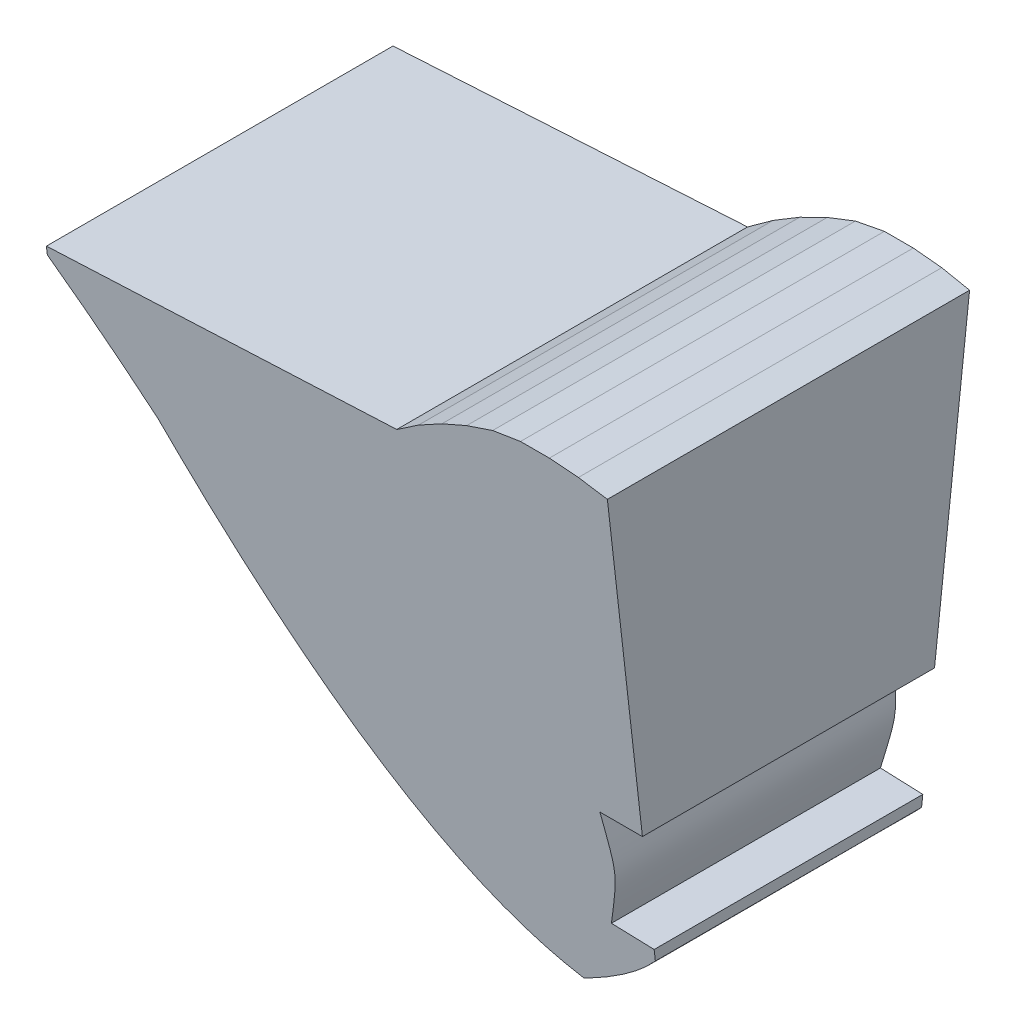
from build123d import *

# Parameters (mm, degrees)
SALIENTE_EXTRUIR1_DEPTH             = 7.21
SALIENTE_EXTRUIR2_DEPTH             = 7.21
SALIENTE_EXTRUIR2_DEPTH_BACK        = 7.21
CORTAR_EXTRUIR2_DEPTH               = 28.232395202
CORTAR_EXTRUIR2_DEPTH_BACK          = 28.232395202
SALIENTE_EXTRUIR3_REACH             = 29.232
SALIENTE_EXTRUIR3_DIRECTION_2_REACH = 29.232


with BuildPart() as part:
    # Croquis1 → Saliente-Extruir1 (new, symmetric)
    with BuildSketch(Plane.XY):
        with BuildLine():
            add(Edge.make_bspline(
                [(-18.945192114, 7.540918896), (-10.215008384, -3.697644103), (-2.846604825, -5.059081104)],
                knots=[0.497667241, 0.497667241, 0.497667241, 0.49955428, 0.49955428, 0.49955428], degree=2, weights=[1, 1, 1]))
            add(Edge.make_bspline(
                [(-2.846604825, -5.059081104), (-0.742366882, -3.9352066), (0.355125, -2.723253227)],
                knots=[0.498812075, 0.498812075, 0.498812075, 0.499412845, 0.499412845, 0.499412845], degree=2, weights=[1, 1, 1]))
            Line((0.355125, -2.723253227), (0.355125, -2.284841781))
            Line((0.355125, -2.284841781), (-1.394875, -2.223730435))
            add(Edge.make_bspline(
                [(-1.394875, -2.223730435), (-0.90753067, -0.123730435), (-1.394875, 1.976269565)],
                knots=[0, 0, 0, 1, 1, 1], degree=2, weights=[1, 3.231801219, 1]))
            Line((-1.394875, 1.976269565), (0.355125, 2.284841781))
            Line((0.355125, 2.284841781), (0.355125, 3.001549529))
            add(Edge.make_bspline(
                [(0.355125, 3.001549529), (-1.44872627, 6.058427314), (-6.994875026, 10.477389992)],
                knots=[0.500820705, 0.500820705, 0.500820705, 0.502013312, 0.502013312, 0.502013312], degree=2, weights=[1, 1, 1]))
            Line((-6.994875026, 10.477389992), (-8.981845695, 12.608155172))
            Line((-8.981845695, 12.608155172), (-23.035921146, 11.871612288))
            Line((-23.035921146, 11.871612288), (-23.035921146, 11.54013782))
            ThreePointArc((-23.035921146, 11.54013782), (-20.949684518, 9.582335705), (-18.945192114, 7.540918896))
        make_face()
    extrude(amount=SALIENTE_EXTRUIR1_DEPTH, both=True)

    # Croquis4 → Saliente-Extruir2 (add, two sides: drawn at the far end of the back side and taken through both)
    with BuildSketch(Plane.XY.offset(-SALIENTE_EXTRUIR2_DEPTH_BACK)):
        Polygon((-1.394875, 1.976269565), (0.355125, 2.284841781), (0.355125, 1.976269565), align=None)
    extrude(amount=SALIENTE_EXTRUIR2_DEPTH + SALIENTE_EXTRUIR2_DEPTH_BACK)

    # Croquis6 → Cortar-Extruir2 (cut, two sides: drawn at the far end of the back side and taken through both)
    with BuildSketch(Plane(origin=(0, 0, 0), x_dir=(0, 0, -1), z_dir=(1, 0, 0)).offset(-CORTAR_EXTRUIR2_DEPTH_BACK)):
        Polygon((7.21, 12.608155172), (7.21, -5.059081104), (5.21, -5.059081104), align=None)
        Polygon((-7.21, 12.608155172), (-7.21, -5.059081104), (-5.21, -5.059081104), align=None)
    extrude(amount=CORTAR_EXTRUIR2_DEPTH + CORTAR_EXTRUIR2_DEPTH_BACK, mode=Mode.SUBTRACT)

    # Saliente-Extruir3: up to this plane
    saliente_extruir3_end = Plane(origin=(-23.035921146, 12.608155172, 7.21), z_dir=(0, 0.1124854344122626, -0.9936533736897816))
    # Croquis8 → Saliente-Extruir3 (add, up to the surface)
    with BuildSketch(Plane.XY, mode=Mode.PRIVATE) as saliente_extruir3_sk1:
        with BuildLine():
            Line((0.355125, 3.001549529), (0.355125, 14.709180541))
            Line((0.355125, 14.709180541), (-0.813523632, 14.915244826))
            Line((-0.813523632, 14.915244826), (-1.99568489, 15.018670535))
            Line((-1.99568489, 15.018670535), (-3.182361811, 15.018670535))
            Line((-3.182361811, 15.018670535), (-4.351010444, 14.81260625))
            Line((-4.351010444, 14.81260625), (-5.46612199, 14.406738839))
            Line((-5.46612199, 14.406738839), (-6.541616524, 13.905227501))
            Line((-6.541616524, 13.905227501), (-7.569308884, 13.311889041))
            Line((-7.569308884, 13.311889041), (-8.54137771, 12.631239121))
            Line((-8.54137771, 12.631239121), (-9.726428332, 12.56913325))
            add(Edge.make_bspline(
                [(-9.726428332, 12.56913325), (-1.861127424, 6.757298639), (0.355125, 3.001549529)],
                knots=[0.500548048, 0.500548048, 0.500548048, 0.502013312, 0.502013312, 0.502013312], degree=2, weights=[1, 1, 1]))
        make_face()
    saliente_extruir3_tool1 = split(extrude(saliente_extruir3_sk1.sketch, amount=SALIENTE_EXTRUIR3_REACH, mode=Mode.PRIVATE), bisect_by=saliente_extruir3_end, keep=Keep.BOTH, mode=Mode.PRIVATE)
    add(saliente_extruir3_tool1.solids().sort_by_distance((-2.98265, 10.736173, 0))[0])

    # Saliente-Extruir3 direction 2: up to this plane
    saliente_extruir3_direction_2_end = Plane(origin=(-23.035921146, 12.608155172, -7.21), z_dir=(0, 0.1124854344122626, 0.9936533736897816))
    # Croquis8 → Saliente-Extruir3 direction 2 (add, up to the surface)
    with BuildSketch(Plane.XY, mode=Mode.PRIVATE) as saliente_extruir3_direction_2_sk1:
        with BuildLine():
            Line((0.355125, 3.001549529), (0.355125, 14.709180541))
            Line((0.355125, 14.709180541), (-0.813523632, 14.915244826))
            Line((-0.813523632, 14.915244826), (-1.99568489, 15.018670535))
            Line((-1.99568489, 15.018670535), (-3.182361811, 15.018670535))
            Line((-3.182361811, 15.018670535), (-4.351010444, 14.81260625))
            Line((-4.351010444, 14.81260625), (-5.46612199, 14.406738839))
            Line((-5.46612199, 14.406738839), (-6.541616524, 13.905227501))
            Line((-6.541616524, 13.905227501), (-7.569308884, 13.311889041))
            Line((-7.569308884, 13.311889041), (-8.54137771, 12.631239121))
            Line((-8.54137771, 12.631239121), (-9.726428332, 12.56913325))
            add(Edge.make_bspline(
                [(-9.726428332, 12.56913325), (-1.861127424, 6.757298639), (0.355125, 3.001549529)],
                knots=[0.500548048, 0.500548048, 0.500548048, 0.502013312, 0.502013312, 0.502013312], degree=2, weights=[1, 1, 1]))
        make_face()
    saliente_extruir3_direction_2_tool1 = split(extrude(saliente_extruir3_direction_2_sk1.sketch, amount=-SALIENTE_EXTRUIR3_DIRECTION_2_REACH, mode=Mode.PRIVATE), bisect_by=saliente_extruir3_direction_2_end, keep=Keep.BOTH, mode=Mode.PRIVATE)
    add(saliente_extruir3_direction_2_tool1.solids().sort_by_distance((-2.98265, 10.736173, 0))[0])


solid = part.part
